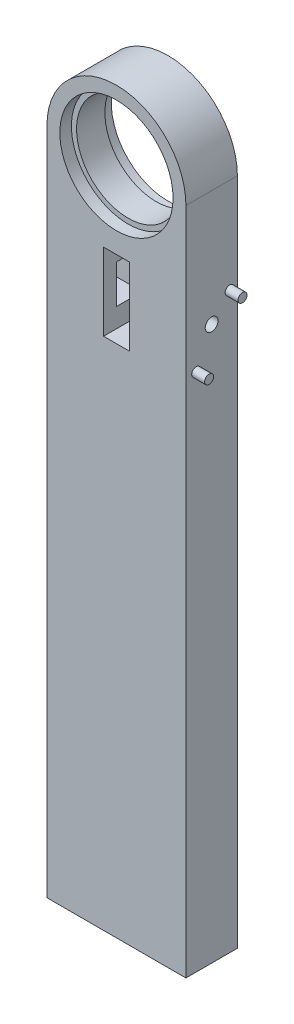
from build123d import *

# Parameters (mm, degrees)
SKETCH1_R               = 22
BOSS_EXTRUDE1_DEPTH     = 5
SKETCH2_R               = 22
SKETCH2_R_2             = 20
BOSS_EXTRUDE2_DEPTH     = 0.5
BOSS_EXTRUDE4_START     = -15
SKETCH1_2_R             = 22
BOSS_EXTRUDE4_DEPTH     = 15
BOSS_EXTRUDE5_START     = -10.5
SKETCH2_2_R             = 22
SKETCH2_2_R_2           = 20
BOSS_EXTRUDE5_DEPTH     = 10.5
CUT_EXTRUDE1_DEPTH      = 263.162163555
CUT_EXTRUDE1_DEPTH_BACK = 263.162163555
SKETCH6_W               = 10
SKETCH6_H               = 30
CUT_EXTRUDE2_DEPTH      = 10
SKETCH8_R               = 2.5
CUT_EXTRUDE3_DEPTH      = 27
SKETCH9_R               = 1.75
BOSS_EXTRUDE6_DEPTH     = 5


with BuildPart() as part:
    # Sketch1 → Boss-Extrude1 (new body)
    with BuildSketch(Plane.XY):
        with BuildLine():
            Line((-27, -260), (27, -260))
            Line((27, -260), (27, 0))
            ThreePointArc((27, 0), (0, 27), (-27, 0))
            Line((-27, 0), (-27, -260))
        make_face()
        Circle(SKETCH1_R, mode=Mode.SUBTRACT)
    extrude(amount=BOSS_EXTRUDE1_DEPTH)

    # Sketch2 → Boss-Extrude2 (add)
    with BuildSketch(Plane.XY):
        Circle(SKETCH2_R)
        Circle(SKETCH2_R_2, mode=Mode.SUBTRACT)
    extrude(amount=BOSS_EXTRUDE2_DEPTH)

    # Sketch1<2> → Boss-Extrude4 (add)
    with BuildSketch(Plane.XY.offset(BOSS_EXTRUDE4_START)):
        with BuildLine():
            Line((-27, -260), (27, -260))
            Line((27, -260), (27, 0))
            ThreePointArc((27, 0), (0, 27), (-27, 0))
            Line((-27, 0), (-27, -260))
        make_face()
        Circle(SKETCH1_2_R, mode=Mode.SUBTRACT)
    extrude(amount=BOSS_EXTRUDE4_DEPTH)

    # Sketch2<2> → Boss-Extrude5 (add)
    with BuildSketch(Plane.XY.offset(BOSS_EXTRUDE5_START)):
        Circle(SKETCH2_2_R)
        Circle(SKETCH2_2_R_2, mode=Mode.SUBTRACT)
    extrude(amount=BOSS_EXTRUDE5_DEPTH)

    # Sketch6 → Cut-Extrude1 (cut, two sides: drawn at the far end of the back side and taken through both)
    with BuildSketch(Plane.XY.offset(5).offset(-CUT_EXTRUDE1_DEPTH_BACK)):
        with Locations((0, -45)):
            Rectangle(SKETCH6_W, SKETCH6_H)
    extrude(amount=CUT_EXTRUDE1_DEPTH + CUT_EXTRUDE1_DEPTH_BACK, mode=Mode.SUBTRACT)

    # Sketch7 → Cut-Extrude2 (cut)
    with BuildSketch(Plane.XY):
        Polygon((-15, -52.5), (-5, -52.5), (-5, -47.5), (-5, -37.5), (-15, -37.5), align=None)
    extrude(amount=-CUT_EXTRUDE2_DEPTH, mode=Mode.SUBTRACT)

    # Sketch8 → Cut-Extrude3 (cut)
    with BuildSketch(Plane(origin=(0, 0, 0), x_dir=(0, 0, -1), z_dir=(1, 0, 0))):
        with Locations(Location((5, -45, 0), (0, 0, 270))):
            Circle(SKETCH8_R)
    extrude(amount=CUT_EXTRUDE3_DEPTH, mode=Mode.SUBTRACT)

    # Sketch9 → Boss-Extrude6 (add)
    with BuildSketch(Plane(origin=(27, 0, 0), x_dir=(0, 0, -1), z_dir=(1, 0, 0))):
        with Locations(Location((12, -37, 0), (0, 0, 270))):
            Circle(SKETCH9_R)
        with Locations(Location((-1, -58, 0), (0, 0, 270))):
            Circle(SKETCH9_R)
    extrude(amount=BOSS_EXTRUDE6_DEPTH)


solid = part.part
